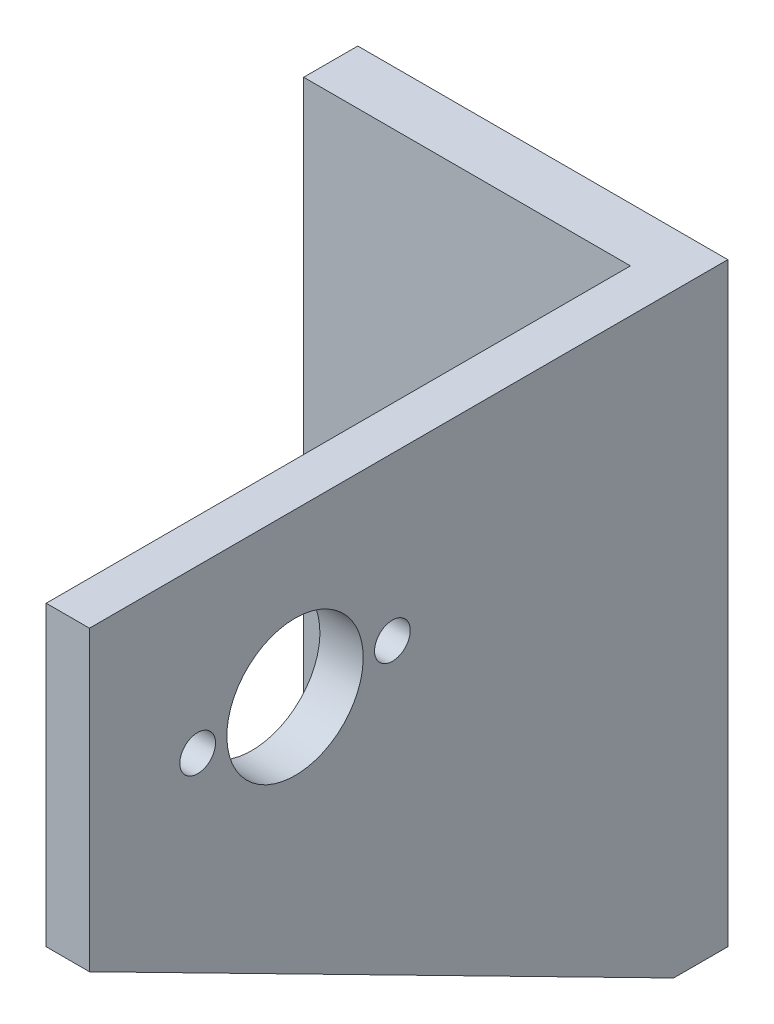
from build123d import *

# Parameters (mm, degrees)
SKETCH_2_R          = 1.65
SKETCH_2_R_2        = 6.3
EXTRUDE_1_DEPTH     = 5
SKETCH_4_W          = 4
SKETCH_4_H          = 55
EXTRUDE_3_DEPTH     = 54
CUT_EXTRUDE_1_DEPTH = 54


with BuildPart() as part:
    # 草图2 → 凸台-拉伸1 (new body)
    with BuildSketch(Plane.XY):
        Polygon((15.6, 35), (0, 35), (-15.6, 35), (-15.6, -20), (18.6, -20), (18.6, 35), align=None)
        with Locations((-9, -5)):
            Circle(SKETCH_2_R, mode=Mode.SUBTRACT)
        with Locations((0, -5)):
            Circle(SKETCH_2_R_2, mode=Mode.SUBTRACT)
        with Locations((9, -5)):
            Circle(SKETCH_2_R, mode=Mode.SUBTRACT)
    extrude(amount=EXTRUDE_1_DEPTH)

    # 草图4 → 凸台-拉伸3 (add)
    with BuildSketch(Plane.XY.offset(5)):
        with Locations((16.6, 7.5)):
            Rectangle(SKETCH_4_W, SKETCH_4_H)
    extrude(amount=EXTRUDE_3_DEPTH)

    # 草图6 → 切除-拉伸1 (cut)
    with BuildSketch(Plane(origin=(0, 0, 0), x_dir=(0, 0, -1), z_dir=(1, 0, 0))):
        Polygon((-59, 7.5), (-59, -20), (-5, -20), align=None)
        with BuildLine():
            ThreePointArc((-32.65, 20), (-31, 18.35), (-29.35, 20))
            Line((-29.35, 20), (-32.65, 20))
        make_face()
        with BuildLine():
            Line((-32.65, 20), (-29.35, 20))
            ThreePointArc((-29.35, 20), (-31, 21.65), (-32.65, 20))
        make_face()
        with BuildLine():
            ThreePointArc((-33.7, 20), (-40, 26.3), (-46.3, 20))
            Line((-46.3, 20), (-33.7, 20))
        make_face()
        with BuildLine():
            Line((-33.7, 20), (-46.3, 20))
            ThreePointArc((-46.3, 20), (-40, 13.7), (-33.7, 20))
        make_face()
        with BuildLine():
            ThreePointArc((-47.35, 20), (-49, 21.65), (-50.65, 20))
            Line((-50.65, 20), (-47.35, 20))
        make_face()
        with BuildLine():
            Line((-47.35, 20), (-50.65, 20))
            ThreePointArc((-50.65, 20), (-49, 18.35), (-47.35, 20))
        make_face()
    extrude(amount=CUT_EXTRUDE_1_DEPTH, mode=Mode.SUBTRACT)


solid = part.part
